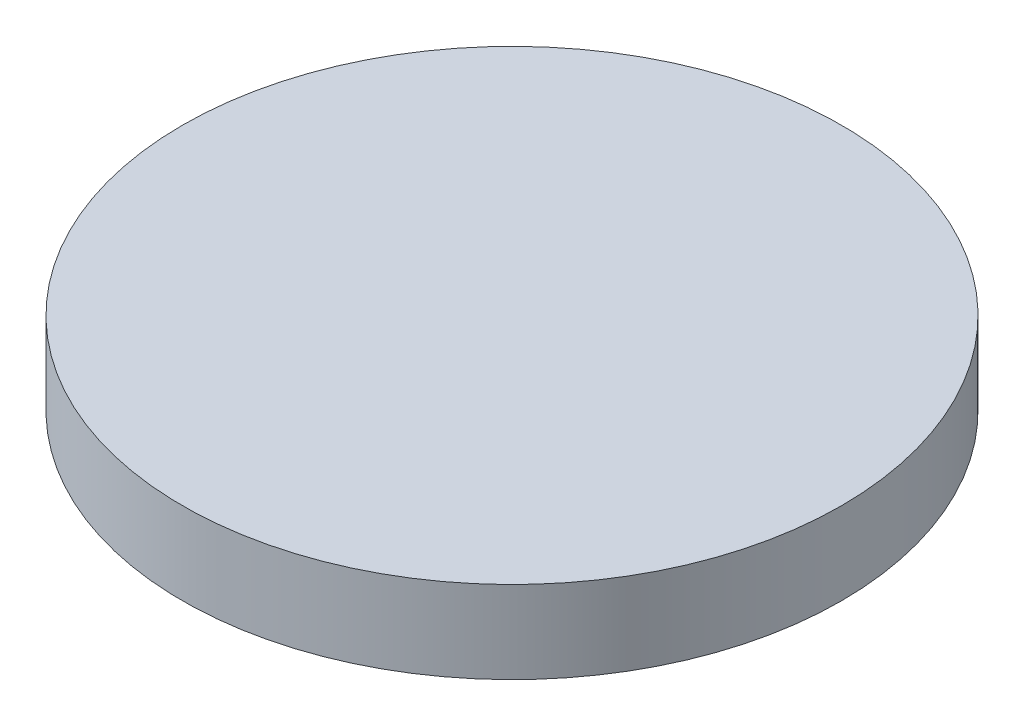
from build123d import *

# Parameters (mm, degrees)
SKETCH1_W = 12.7
SKETCH1_H = 3.175


with BuildPart() as part:
    # Sketch1 → Revolve1 (revolve)
    with BuildSketch(Plane.XY):
        with Locations((6.35, 1.5875)):
            Rectangle(SKETCH1_W, SKETCH1_H)
    revolve(axis=Axis((0, 0, 0), (0, 1, 0)))


solid = part.part
